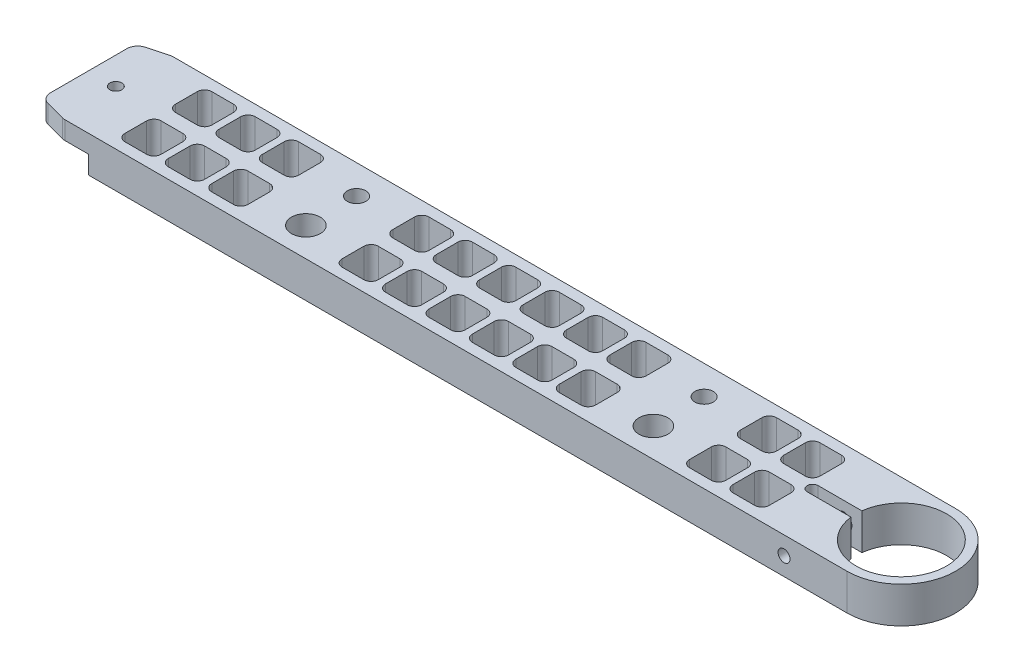
from build123d import *

# Parameters (mm, degrees)
EXTRUDE_1_DEPTH             = 10
SKETCH_4_W                  = 15
SKETCH_4_H                  = 30
CUT_EXTRUDE_2_DEPTH         = 5
FILLET_1_R                  = 3
CUT_EXTRUDE_3_DEPTH         = 243.074368738
SKETCH_6_W                  = 23.844659042
SKETCH_6_H                  = 25.610930083
SKETCH_6_W_2                = 24.286226803
EXTRUDE_2_DEPTH             = 10
HOLE_WIZARD_1_4_201_D       = 5.1054
HOLE_WIZARD_3_8_161_D       = 7.9375
SKETCH_12_R                 = 12.5
CUT_EXTRUDE_4_DEPTH         = 243.074368738
SKETCH_13_W                 = 12.089662748
SKETCH_13_H                 = 26.414389197
EXTRUDE_3_DEPTH             = 10
CUT_EXTRUDE_5_DEPTH         = 10
SKETCH_16_W                 = 1.65
SKETCH_16_H                 = 13.5
HOLE_WIZARD_M41_D           = 4.5
HOLE_WIZARD_M41_DEPTH       = 13.5
HOLE_WIZARD_M41_CBORE_D     = 8
HOLE_WIZARD_M41_CBORE_DEPTH = 4
M4X0_72_D                   = 3.3


with BuildPart() as part:
    # Эскиз1 → Бобышка-Вытянуть1 (new body)
    with BuildSketch(Plane(origin=(0, 0, 0), x_dir=(1, 0, 0), z_dir=(0, 1, 0))):
        Polygon((15, 0), (240, 0), (240, 30), (15, 30), (8, 30), (0, 27.856406461), (0, 2.143593539), (8, 0), align=None)
    extrude(amount=EXTRUDE_1_DEPTH)

    # Эскиз4 → Вырез-Вытянуть2 (cut)
    with BuildSketch(Plane.XZ):
        with Locations((7.5, -15)):
            Rectangle(SKETCH_4_W, SKETCH_4_H)
    extrude(amount=-CUT_EXTRUDE_2_DEPTH, mode=Mode.SUBTRACT)

    # Скругление1
    fillet_1_edges = [part.edges().sort_by_distance(p)[0] for p in [
        (8, 7.5, 0),
        (0, 7.5, -2.143593539),
        (0, 7.5, -27.856406461),
        (8, 7.5, -30),
    ]]
    fillet(fillet_1_edges, radius=FILLET_1_R)

    # Эскиз5 → Вырез-Вытянуть3 (cut, through all)
    with BuildSketch(Plane.XZ):
        with BuildLine():
            Line((22, -17), (28, -17))
            ThreePointArc((28, -17), (29.414213562, -17.585786438), (30, -19))
            Line((30, -19), (30, -25))
            ThreePointArc((30, -25), (29.414213562, -26.414213562), (28, -27))
            Line((28, -27), (22, -27))
            ThreePointArc((22, -27), (20.585786438, -26.414213562), (20, -25))
            Line((20, -25), (20, -19))
            ThreePointArc((20, -19), (20.585786438, -17.585786438), (22, -17))
        make_face()
        with BuildLine():
            Line((34, -17), (40, -17))
            ThreePointArc((40, -17), (41.414213562, -17.585786438), (42, -19))
            Line((42, -19), (42, -25))
            ThreePointArc((42, -25), (41.414213562, -26.414213562), (40, -27))
            Line((40, -27), (34, -27))
            ThreePointArc((34, -27), (32.585786438, -26.414213562), (32, -25))
            Line((32, -25), (32, -19))
            ThreePointArc((32, -19), (32.585786438, -17.585786438), (34, -17))
        make_face()
        with BuildLine():
            Line((46, -17), (52, -17))
            ThreePointArc((52, -17), (53.414213562, -17.585786438), (54, -19))
            Line((54, -19), (54, -25))
            ThreePointArc((54, -25), (53.414213562, -26.414213562), (52, -27))
            Line((52, -27), (46, -27))
            ThreePointArc((46, -27), (44.585786438, -26.414213562), (44, -25))
            Line((44, -25), (44, -19))
            ThreePointArc((44, -19), (44.585786438, -17.585786438), (46, -17))
        make_face()
        with BuildLine():
            Line((58, -17), (64, -17))
            ThreePointArc((64, -17), (65.414213562, -17.585786438), (66, -19))
            Line((66, -19), (66, -25))
            ThreePointArc((66, -25), (65.414213562, -26.414213562), (64, -27))
            Line((64, -27), (58, -27))
            ThreePointArc((58, -27), (56.585786438, -26.414213562), (56, -25))
            Line((56, -25), (56, -19))
            ThreePointArc((56, -19), (56.585786438, -17.585786438), (58, -17))
        make_face()
        with BuildLine():
            Line((70, -17), (76, -17))
            ThreePointArc((76, -17), (77.414213562, -17.585786438), (78, -19))
            Line((78, -19), (78, -25))
            ThreePointArc((78, -25), (77.414213562, -26.414213562), (76, -27))
            Line((76, -27), (70, -27))
            ThreePointArc((70, -27), (68.585786438, -26.414213562), (68, -25))
            Line((68, -25), (68, -19))
            ThreePointArc((68, -19), (68.585786438, -17.585786438), (70, -17))
        make_face()
        with BuildLine():
            Line((82, -17), (88, -17))
            ThreePointArc((88, -17), (89.414213562, -17.585786438), (90, -19))
            Line((90, -19), (90, -25))
            ThreePointArc((90, -25), (89.414213562, -26.414213562), (88, -27))
            Line((88, -27), (82, -27))
            ThreePointArc((82, -27), (80.585786438, -26.414213562), (80, -25))
            Line((80, -25), (80, -19))
            ThreePointArc((80, -19), (80.585786438, -17.585786438), (82, -17))
        make_face()
        with BuildLine():
            Line((94, -17), (100, -17))
            ThreePointArc((100, -17), (101.414213562, -17.585786438), (102, -19))
            Line((102, -19), (102, -25))
            ThreePointArc((102, -25), (101.414213562, -26.414213562), (100, -27))
            Line((100, -27), (94, -27))
            ThreePointArc((94, -27), (92.585786438, -26.414213562), (92, -25))
            Line((92, -25), (92, -19))
            ThreePointArc((92, -19), (92.585786438, -17.585786438), (94, -17))
        make_face()
        with BuildLine():
            Line((106, -17), (112, -17))
            ThreePointArc((112, -17), (113.414213562, -17.585786438), (114, -19))
            Line((114, -19), (114, -25))
            ThreePointArc((114, -25), (113.414213562, -26.414213562), (112, -27))
            Line((112, -27), (106, -27))
            ThreePointArc((106, -27), (104.585786438, -26.414213562), (104, -25))
            Line((104, -25), (104, -19))
            ThreePointArc((104, -19), (104.585786438, -17.585786438), (106, -17))
        make_face()
        with BuildLine():
            Line((118, -17), (124, -17))
            ThreePointArc((124, -17), (125.414213562, -17.585786438), (126, -19))
            Line((126, -19), (126, -25))
            ThreePointArc((126, -25), (125.414213562, -26.414213562), (124, -27))
            Line((124, -27), (118, -27))
            ThreePointArc((118, -27), (116.585786438, -26.414213562), (116, -25))
            Line((116, -25), (116, -19))
            ThreePointArc((116, -19), (116.585786438, -17.585786438), (118, -17))
        make_face()
        with BuildLine():
            Line((130, -17), (136, -17))
            ThreePointArc((136, -17), (137.414213562, -17.585786438), (138, -19))
            Line((138, -19), (138, -25))
            ThreePointArc((138, -25), (137.414213562, -26.414213562), (136, -27))
            Line((136, -27), (130, -27))
            ThreePointArc((130, -27), (128.585786438, -26.414213562), (128, -25))
            Line((128, -25), (128, -19))
            ThreePointArc((128, -19), (128.585786438, -17.585786438), (130, -17))
        make_face()
        with BuildLine():
            Line((142, -17), (148, -17))
            ThreePointArc((148, -17), (149.414213562, -17.585786438), (150, -19))
            Line((150, -19), (150, -25))
            ThreePointArc((150, -25), (149.414213562, -26.414213562), (148, -27))
            Line((148, -27), (142, -27))
            ThreePointArc((142, -27), (140.585786438, -26.414213562), (140, -25))
            Line((140, -25), (140, -19))
            ThreePointArc((140, -19), (140.585786438, -17.585786438), (142, -17))
        make_face()
        with BuildLine():
            Line((154, -17), (160, -17))
            ThreePointArc((160, -17), (161.414213562, -17.585786438), (162, -19))
            Line((162, -19), (162, -25))
            ThreePointArc((162, -25), (161.414213562, -26.414213562), (160, -27))
            Line((160, -27), (154, -27))
            ThreePointArc((154, -27), (152.585786438, -26.414213562), (152, -25))
            Line((152, -25), (152, -19))
            ThreePointArc((152, -19), (152.585786438, -17.585786438), (154, -17))
        make_face()
        with BuildLine():
            Line((166, -17), (172, -17))
            ThreePointArc((172, -17), (173.414213562, -17.585786438), (174, -19))
            Line((174, -19), (174, -25))
            ThreePointArc((174, -25), (173.414213562, -26.414213562), (172, -27))
            Line((172, -27), (166, -27))
            ThreePointArc((166, -27), (164.585786438, -26.414213562), (164, -25))
            Line((164, -25), (164, -19))
            ThreePointArc((164, -19), (164.585786438, -17.585786438), (166, -17))
        make_face()
        with BuildLine():
            Line((178, -17), (184, -17))
            ThreePointArc((184, -17), (185.414213562, -17.585786438), (186, -19))
            Line((186, -19), (186, -25))
            ThreePointArc((186, -25), (185.414213562, -26.414213562), (184, -27))
            Line((184, -27), (178, -27))
            ThreePointArc((178, -27), (176.585786438, -26.414213562), (176, -25))
            Line((176, -25), (176, -19))
            ThreePointArc((176, -19), (176.585786438, -17.585786438), (178, -17))
        make_face()
        with BuildLine():
            Line((190, -17), (196, -17))
            ThreePointArc((196, -17), (197.414213562, -17.585786438), (198, -19))
            Line((198, -19), (198, -25))
            ThreePointArc((198, -25), (197.414213562, -26.414213562), (196, -27))
            Line((196, -27), (190, -27))
            ThreePointArc((190, -27), (188.585786438, -26.414213562), (188, -25))
            Line((188, -25), (188, -19))
            ThreePointArc((188, -19), (188.585786438, -17.585786438), (190, -17))
        make_face()
        with BuildLine():
            Line((202, -17), (208, -17))
            ThreePointArc((208, -17), (209.414213562, -17.585786438), (210, -19))
            Line((210, -19), (210, -25))
            ThreePointArc((210, -25), (209.414213562, -26.414213562), (208, -27))
            Line((208, -27), (202, -27))
            ThreePointArc((202, -27), (200.585786438, -26.414213562), (200, -25))
            Line((200, -25), (200, -19))
            ThreePointArc((200, -19), (200.585786438, -17.585786438), (202, -17))
        make_face()
        with BuildLine():
            Line((210, -11), (210, -5))
            ThreePointArc((210, -5), (209.414213562, -3.585786438), (208, -3))
            Line((208, -3), (202, -3))
            ThreePointArc((202, -3), (200.585786438, -3.585786438), (200, -5))
            Line((200, -5), (200, -11))
            ThreePointArc((200, -11), (200.585786438, -12.414213562), (202, -13))
            Line((202, -13), (208, -13))
            ThreePointArc((208, -13), (209.414213562, -12.414213562), (210, -11))
        make_face()
        with BuildLine():
            Line((198, -11), (198, -5))
            ThreePointArc((198, -5), (197.414213562, -3.585786438), (196, -3))
            Line((196, -3), (190, -3))
            ThreePointArc((190, -3), (188.585786438, -3.585786438), (188, -5))
            Line((188, -5), (188, -11))
            ThreePointArc((188, -11), (188.585786438, -12.414213562), (190, -13))
            Line((190, -13), (196, -13))
            ThreePointArc((196, -13), (197.414213562, -12.414213562), (198, -11))
        make_face()
        with BuildLine():
            Line((186, -11), (186, -5))
            ThreePointArc((186, -5), (185.414213562, -3.585786438), (184, -3))
            Line((184, -3), (178, -3))
            ThreePointArc((178, -3), (176.585786438, -3.585786438), (176, -5))
            Line((176, -5), (176, -11))
            ThreePointArc((176, -11), (176.585786438, -12.414213562), (178, -13))
            Line((178, -13), (184, -13))
            ThreePointArc((184, -13), (185.414213562, -12.414213562), (186, -11))
        make_face()
        with BuildLine():
            Line((174, -11), (174, -5))
            ThreePointArc((174, -5), (173.414213562, -3.585786438), (172, -3))
            Line((172, -3), (166, -3))
            ThreePointArc((166, -3), (164.585786438, -3.585786438), (164, -5))
            Line((164, -5), (164, -11))
            ThreePointArc((164, -11), (164.585786438, -12.414213562), (166, -13))
            Line((166, -13), (172, -13))
            ThreePointArc((172, -13), (173.414213562, -12.414213562), (174, -11))
        make_face()
        with BuildLine():
            Line((162, -11), (162, -5))
            ThreePointArc((162, -5), (161.414213562, -3.585786438), (160, -3))
            Line((160, -3), (154, -3))
            ThreePointArc((154, -3), (152.585786438, -3.585786438), (152, -5))
            Line((152, -5), (152, -11))
            ThreePointArc((152, -11), (152.585786438, -12.414213562), (154, -13))
            Line((154, -13), (160, -13))
            ThreePointArc((160, -13), (161.414213562, -12.414213562), (162, -11))
        make_face()
        with BuildLine():
            Line((150, -11), (150, -5))
            ThreePointArc((150, -5), (149.414213562, -3.585786438), (148, -3))
            Line((148, -3), (142, -3))
            ThreePointArc((142, -3), (140.585786438, -3.585786438), (140, -5))
            Line((140, -5), (140, -11))
            ThreePointArc((140, -11), (140.585786438, -12.414213562), (142, -13))
            Line((142, -13), (148, -13))
            ThreePointArc((148, -13), (149.414213562, -12.414213562), (150, -11))
        make_face()
        with BuildLine():
            Line((138, -11), (138, -5))
            ThreePointArc((138, -5), (137.414213562, -3.585786438), (136, -3))
            Line((136, -3), (130, -3))
            ThreePointArc((130, -3), (128.585786438, -3.585786438), (128, -5))
            Line((128, -5), (128, -11))
            ThreePointArc((128, -11), (128.585786438, -12.414213562), (130, -13))
            Line((130, -13), (136, -13))
            ThreePointArc((136, -13), (137.414213562, -12.414213562), (138, -11))
        make_face()
        with BuildLine():
            Line((126, -11), (126, -5))
            ThreePointArc((126, -5), (125.414213562, -3.585786438), (124, -3))
            Line((124, -3), (118, -3))
            ThreePointArc((118, -3), (116.585786438, -3.585786438), (116, -5))
            Line((116, -5), (116, -11))
            ThreePointArc((116, -11), (116.585786438, -12.414213562), (118, -13))
            Line((118, -13), (124, -13))
            ThreePointArc((124, -13), (125.414213562, -12.414213562), (126, -11))
        make_face()
        with BuildLine():
            Line((114, -11), (114, -5))
            ThreePointArc((114, -5), (113.414213562, -3.585786438), (112, -3))
            Line((112, -3), (106, -3))
            ThreePointArc((106, -3), (104.585786438, -3.585786438), (104, -5))
            Line((104, -5), (104, -11))
            ThreePointArc((104, -11), (104.585786438, -12.414213562), (106, -13))
            Line((106, -13), (112, -13))
            ThreePointArc((112, -13), (113.414213562, -12.414213562), (114, -11))
        make_face()
        with BuildLine():
            Line((102, -11), (102, -5))
            ThreePointArc((102, -5), (101.414213562, -3.585786438), (100, -3))
            Line((100, -3), (94, -3))
            ThreePointArc((94, -3), (92.585786438, -3.585786438), (92, -5))
            Line((92, -5), (92, -11))
            ThreePointArc((92, -11), (92.585786438, -12.414213562), (94, -13))
            Line((94, -13), (100, -13))
            ThreePointArc((100, -13), (101.414213562, -12.414213562), (102, -11))
        make_face()
        with BuildLine():
            Line((90, -11), (90, -5))
            ThreePointArc((90, -5), (89.414213562, -3.585786438), (88, -3))
            Line((88, -3), (82, -3))
            ThreePointArc((82, -3), (80.585786438, -3.585786438), (80, -5))
            Line((80, -5), (80, -11))
            ThreePointArc((80, -11), (80.585786438, -12.414213562), (82, -13))
            Line((82, -13), (88, -13))
            ThreePointArc((88, -13), (89.414213562, -12.414213562), (90, -11))
        make_face()
        with BuildLine():
            Line((78, -11), (78, -5))
            ThreePointArc((78, -5), (77.414213562, -3.585786438), (76, -3))
            Line((76, -3), (70, -3))
            ThreePointArc((70, -3), (68.585786438, -3.585786438), (68, -5))
            Line((68, -5), (68, -11))
            ThreePointArc((68, -11), (68.585786438, -12.414213562), (70, -13))
            Line((70, -13), (76, -13))
            ThreePointArc((76, -13), (77.414213562, -12.414213562), (78, -11))
        make_face()
        with BuildLine():
            Line((66, -11), (66, -5))
            ThreePointArc((66, -5), (65.414213562, -3.585786438), (64, -3))
            Line((64, -3), (58, -3))
            ThreePointArc((58, -3), (56.585786438, -3.585786438), (56, -5))
            Line((56, -5), (56, -11))
            ThreePointArc((56, -11), (56.585786438, -12.414213562), (58, -13))
            Line((58, -13), (64, -13))
            ThreePointArc((64, -13), (65.414213562, -12.414213562), (66, -11))
        make_face()
        with BuildLine():
            Line((54, -11), (54, -5))
            ThreePointArc((54, -5), (53.414213562, -3.585786438), (52, -3))
            Line((52, -3), (46, -3))
            ThreePointArc((46, -3), (44.585786438, -3.585786438), (44, -5))
            Line((44, -5), (44, -11))
            ThreePointArc((44, -11), (44.585786438, -12.414213562), (46, -13))
            Line((46, -13), (52, -13))
            ThreePointArc((52, -13), (53.414213562, -12.414213562), (54, -11))
        make_face()
        with BuildLine():
            Line((42, -11), (42, -5))
            ThreePointArc((42, -5), (41.414213562, -3.585786438), (40, -3))
            Line((40, -3), (34, -3))
            ThreePointArc((34, -3), (32.585786438, -3.585786438), (32, -5))
            Line((32, -5), (32, -11))
            ThreePointArc((32, -11), (32.585786438, -12.414213562), (34, -13))
            Line((34, -13), (40, -13))
            ThreePointArc((40, -13), (41.414213562, -12.414213562), (42, -11))
        make_face()
        with BuildLine():
            Line((30, -11), (30, -5))
            ThreePointArc((30, -5), (29.414213562, -3.585786438), (28, -3))
            Line((28, -3), (22, -3))
            ThreePointArc((22, -3), (20.585786438, -3.585786438), (20, -5))
            Line((20, -5), (20, -11))
            ThreePointArc((20, -11), (20.585786438, -12.414213562), (22, -13))
            Line((22, -13), (28, -13))
            ThreePointArc((28, -13), (29.414213562, -12.414213562), (30, -11))
        make_face()
    extrude(amount=-CUT_EXTRUDE_3_DEPTH, mode=Mode.SUBTRACT)

    # Эскиз6 → Бобышка-Вытянуть2 (add, through all)
    with BuildSketch(Plane.XZ):
        with Locations((66.835729878, -14.983546906)):
            Rectangle(SKETCH_6_W, SKETCH_6_H)
        with Locations((163.057950753, -14.983546906)):
            Rectangle(SKETCH_6_W_2, SKETCH_6_H)
    extrude(amount=-EXTRUDE_2_DEPTH)

    # Отверстие обработанное метчиком 1/4-201 (through all)
    with Locations(Plane(origin=(0, 0, 0), x_dir=(-1, 0, 0), z_dir=(0, -1, 0))):
        with Locations((-67, 22), (-163, 22)):
            Hole(HOLE_WIZARD_1_4_201_D / 2)

    # Отверстие обработанное метчиком 3/8-161 (through all)
    with Locations(Plane(origin=(0, 0, 0), x_dir=(-1, 0, 0), z_dir=(0, -1, 0))):
        with Locations((-163, 8), (-67, 8)):
            Hole(HOLE_WIZARD_3_8_161_D / 2)

    # Эскиз12 → Вырез-Вытянуть4 (cut, through all)
    with BuildSketch(Plane.XZ):
        with Locations(Location((224.5, -15, 0), (0, 0, 270))):
            Circle(SKETCH_12_R)
        with BuildLine():
            Line((224.5, -30), (240, -30))
            Line((240, -30), (240, 0))
            Line((240, 0), (224.5, 0))
            ThreePointArc((224.5, 0), (239.5, -15), (224.5, -30))
        make_face()
    extrude(amount=-CUT_EXTRUDE_4_DEPTH, mode=Mode.SUBTRACT)

    # Эскиз13 → Бобышка-Вытянуть3 (add, through all)
    with BuildSketch(Plane.XZ):
        with Locations((204.936183739, -15.076136097)):
            Rectangle(SKETCH_13_W, SKETCH_13_H)
    extrude(amount=-EXTRUDE_3_DEPTH)

    # Эскиз14 → Вырез-Вытянуть5 (cut)
    with BuildSketch(Plane.XZ):
        with BuildLine():
            Line((200, -13.5), (213.598015613, -13.5))
            ThreePointArc((213.598015613, -13.5), (215.098015613, -15), (213.598015613, -16.5))
            Line((213.598015613, -16.5), (200, -16.5))
            ThreePointArc((200, -16.5), (198.5, -15), (200, -13.5))
        make_face()
    extrude(amount=-CUT_EXTRUDE_5_DEPTH, mode=Mode.SUBTRACT)

    # Эскиз16 → Отверстие обработанное метчиком M4x0.71 (revolve, cut)
    with BuildSketch(Plane(origin=(207.090326354, 5, -13.5), x_dir=(0, 1, 0), z_dir=(1, 0, 0))):
        with Locations((0.825, 6.75)):
            Rectangle(SKETCH_16_W, SKETCH_16_H)
    revolve(axis=Axis((207.090326354, 5, -19.85), (0, 0, 1)), mode=Mode.SUBTRACT)

    # Цековка для винта с внутренним шестигранником M41
    with Locations(Plane(origin=(0, 0, -30), x_dir=(-1, 0, 0), z_dir=(0, 0, -1))):
        with Locations((-207.090326354, 5)):
            CounterBoreHole(HOLE_WIZARD_M41_D / 2, HOLE_WIZARD_M41_CBORE_D / 2, HOLE_WIZARD_M41_CBORE_DEPTH, depth=HOLE_WIZARD_M41_DEPTH)

    # Отверстие обработанное метчиком M4x0.72 (through all)
    with Locations(Plane(origin=(0, 5, 0), x_dir=(-1, 0, 0), z_dir=(0, -1, 0))):
        with Locations((-7.5, 15)):
            Hole(M4X0_72_D / 2)


solid = part.part
